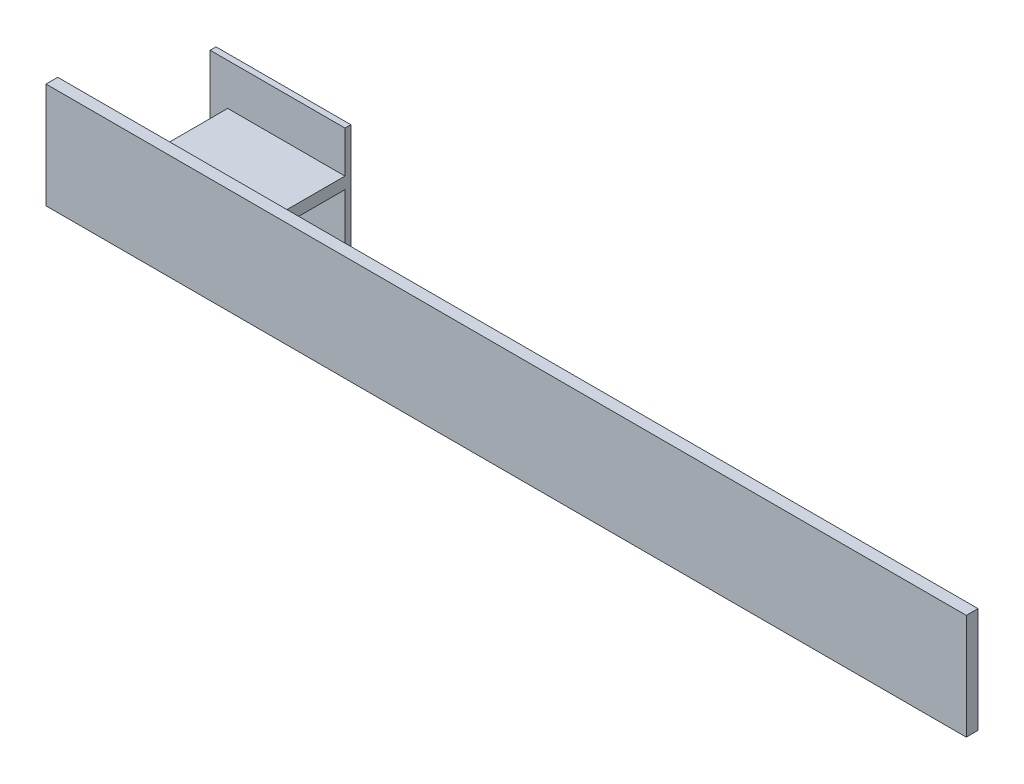
from build123d import *

# Parameters (mm, degrees)
SKETCH1_W           = 157
SKETCH1_H           = 18
BOSS_EXTRUDE1_DEPTH = 2
SKETCH2_W           = 20
SKETCH2_H           = 2
BOSS_EXTRUDE2_DEPTH = 17
SKETCH3_W           = 23
SKETCH3_H           = 18
BOSS_EXTRUDE3_DEPTH = 1


with BuildPart() as part:
    # Sketch1 → Boss-Extrude1 (new body)
    with BuildSketch(Plane.XY):
        with Locations((78.5, 9)):
            Rectangle(SKETCH1_W, SKETCH1_H)
    extrude(amount=BOSS_EXTRUDE1_DEPTH)

    # Sketch2 → Boss-Extrude2 (add)
    with BuildSketch(Plane(origin=(0, 0, 0), x_dir=(-1, 0, 0), z_dir=(0, 0, -1))):
        with Locations((-22, 9.9)):
            Rectangle(SKETCH2_W, SKETCH2_H)
    extrude(amount=BOSS_EXTRUDE2_DEPTH)

    # Sketch3 → Boss-Extrude3 (add)
    with BuildSketch(Plane(origin=(0, 0, -17), x_dir=(-1, 0, 0), z_dir=(0, 0, -1))):
        with Locations((-20.5, 9)):
            Rectangle(SKETCH3_W, SKETCH3_H)
    extrude(amount=BOSS_EXTRUDE3_DEPTH)


solid = part.part
